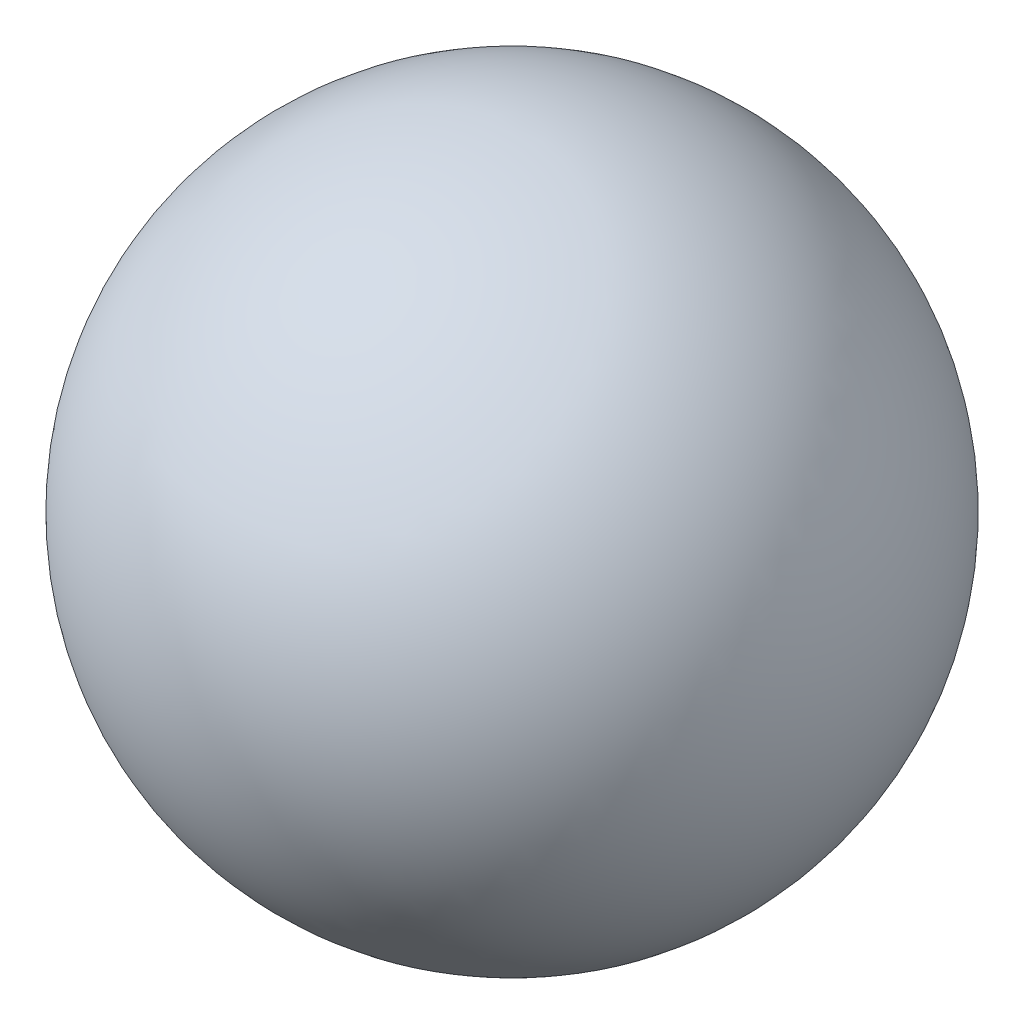
from build123d import *


with BuildPart() as part:
    # Esquisse1 → Révolution1 (revolve)
    with BuildSketch(Plane.XY):
        with BuildLine():
            Line((0, 6.4), (0, -6.4))
            ThreePointArc((0, -6.4), (-6.4, 0), (0, 6.4))
        make_face()
    revolve(axis=Axis((0, 6.4, 0), (0, -1, 0)))


solid = part.part
